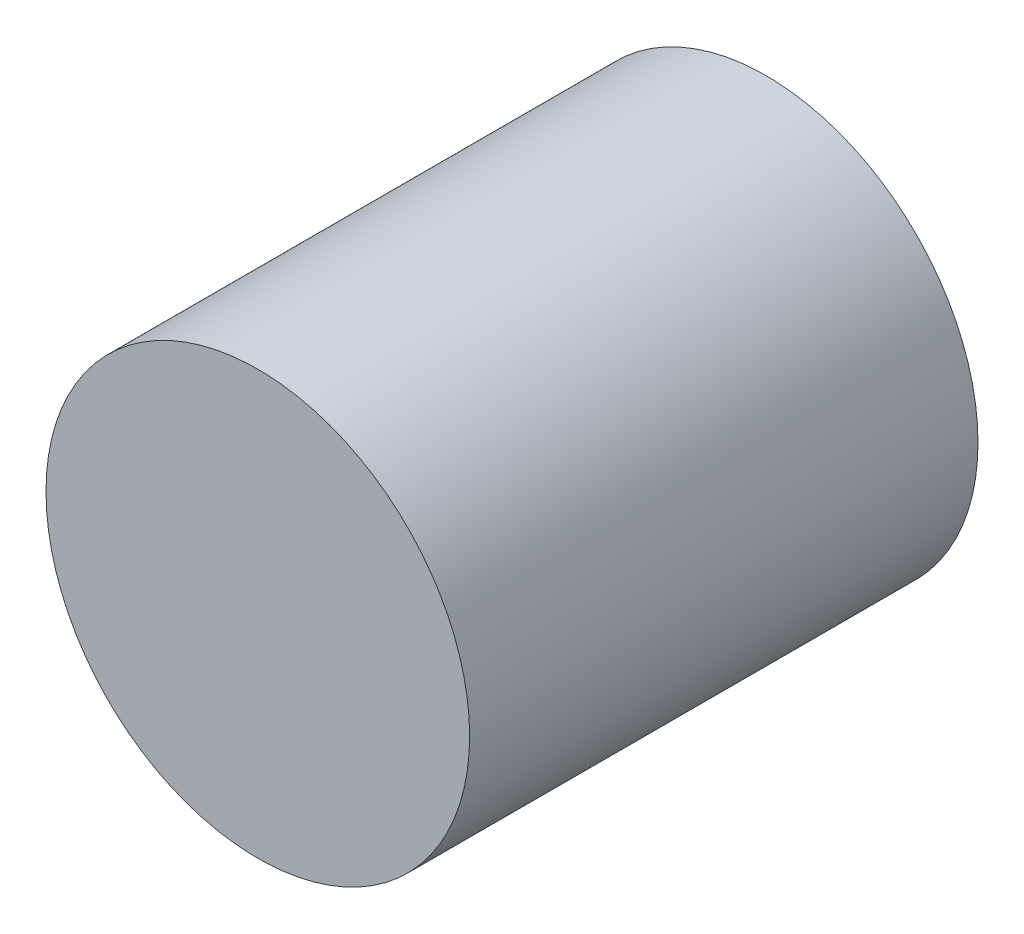
from build123d import *

# Parameters (mm, degrees)
ESQUISSE1_R        = 25
BOSS_EXTRU_1_DEPTH = 60


with BuildPart() as part:
    # Esquisse1 → Boss.-Extru.1 (new body)
    with BuildSketch(Plane.XY):
        Circle(ESQUISSE1_R)
    extrude(amount=BOSS_EXTRU_1_DEPTH)


solid = part.part
